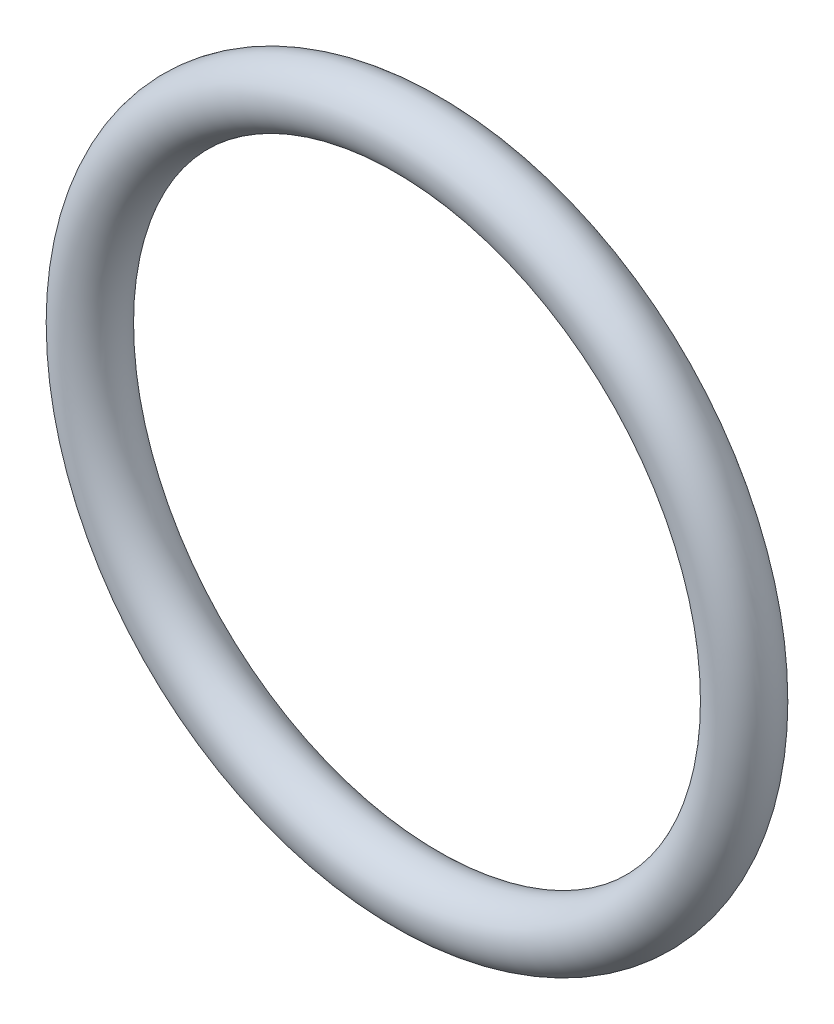
from build123d import *

# Parameters (mm, degrees)
SKETCH1_R = 1.3081


with BuildPart() as part:
    # Sketch1 → Revolve1 (revolve)
    with BuildSketch(Plane(origin=(0, 0, 0), x_dir=(0, -1, 0), z_dir=(1, 0, 0))):
        with Locations((13.843, 0)):
            Circle(SKETCH1_R)
    revolve(axis=Axis((0, 0, 1.3081), (0, 0, -1)))


solid = part.part
